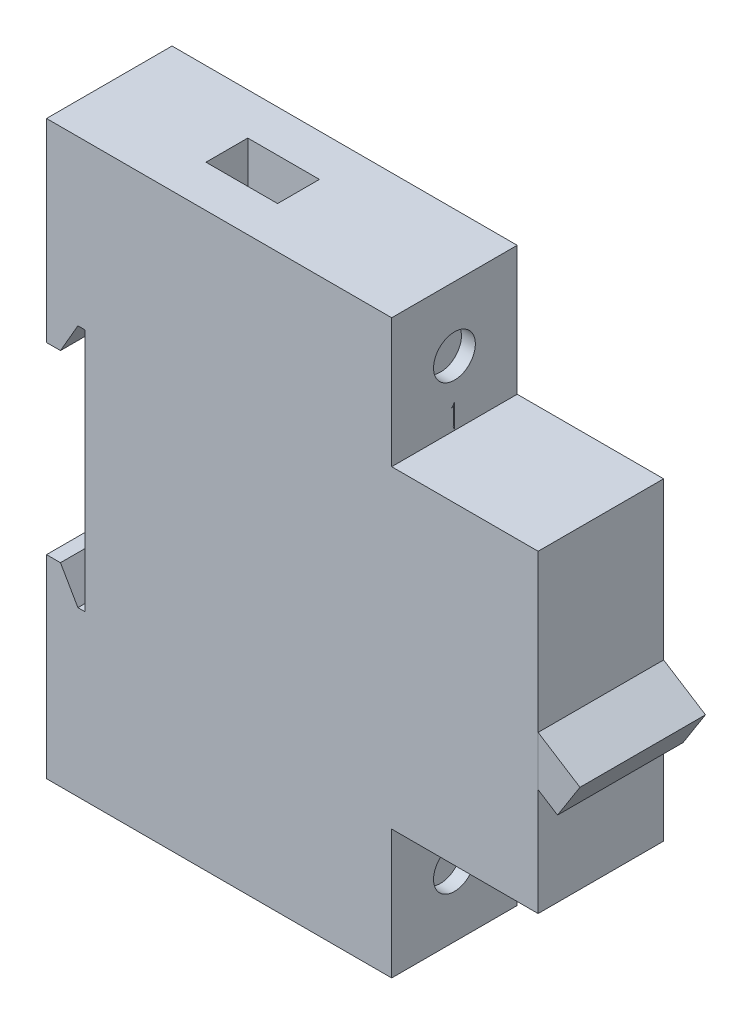
from build123d import *

# Parameters (mm, degrees)
EXTRUDE_1_DEPTH     = 18
SKETCH_2_R          = 3
CUT_EXTRUDE_1_DEPTH = 2
SKETCH_7_W          = 10.27440821
SKETCH_7_H          = 6
CUT_EXTRUDE_2_DEPTH = 8
EXTRUDE_3_DEPTH     = 18
CUT_EXTRUDE_3_DEPTH = 1


with BuildPart() as part:
    # 草图1 → 凸台-拉伸1 (new body)
    with BuildSketch(Plane.XY):
        Polygon((0, 13.169872981), (2, 13.169872981), (4.5, 17.5), (5.5, 17.5), (5.5, -17.5), (4.5, -17.5), (2, -13.169872981), (0, -13.169872981), (0, -41), (49.5, -41), (49.5, -22.5), (70.5, -22.5), (70.5, 22.5), (49.5, 22.5), (49.5, 41), (0, 41), align=None)
    extrude(amount=-EXTRUDE_1_DEPTH)

    # 草图2 → 切除-拉伸1 (cut)
    with BuildSketch(Plane(origin=(49.5, 0, 0), x_dir=(0, 0, -1), z_dir=(1, 0, 0))):
        with Locations((9, 31.75)):
            Circle(SKETCH_2_R)
    cut_extrude_1 = extrude(amount=-CUT_EXTRUDE_1_DEPTH, mode=Mode.SUBTRACT)

    # 草图7 → 切除-拉伸2 (cut)
    with BuildSketch(Plane(origin=(0, 41, 0), x_dir=(1, 0, 0), z_dir=(0, 1, 0))):
        with Locations((22, 9)):
            Rectangle(SKETCH_7_W, SKETCH_7_H)
    cut_extrude_2 = extrude(amount=-CUT_EXTRUDE_2_DEPTH, mode=Mode.SUBTRACT)

    # 镜向1: 切除-拉伸1, 切除-拉伸2 across plane
    add(cut_extrude_1.mirror(Plane.ZX), mode=Mode.SUBTRACT)
    add(cut_extrude_2.mirror(Plane.ZX), mode=Mode.SUBTRACT)

    # 草图4 → 凸台-拉伸3 (add, through all)
    with BuildSketch(Plane.XY):
        Polygon((70.5, 0), (76.5, -3.811982778), (73.282472113, -8.876320276), (70.5, -7.10853098), align=None)
    extrude(amount=-EXTRUDE_3_DEPTH)

    # 草图10 → 切除-拉伸3 (cut)
    with BuildSketch(Plane(origin=(49.5, 0, 0), x_dir=(0, 0, -1), z_dir=(1, 0, 0))):
        with BuildLine():
            Line((8.984338376, 26.034306414), (9.039526955, 26.034306414))
            Line((9.039526955, 26.034306414), (9.034306414, 23.360643512))
            add(Edge.make_bspline(
                [(9.034306414, 23.360643512), (9.033711696, 23.336531223), (9.032571392, 23.290298592), (9.032478847, 23.224151689), (9.030303434, 23.164261802), (9.030130163, 23.110543188), (9.028512562, 23.063066024), (9.026641962, 23.021820374), (9.026464219, 22.986728926), (9.023155462, 22.931806279), (9.01921264, 22.856291737), (9.009434644, 22.778513041), (9.001650625, 22.723092466), (8.993737527, 22.697864051), (8.983712444, 22.677902503), (8.973707431, 22.680230387), (8.969422544, 22.68122736)],
                knots=[0, 0, 0, 0, 1.45038606, 2.780953852, 3.977268029, 5.053718292, 6.010937745, 6.833690271, 7.536464333, 8.120251454, 10.142880859, 12.069479857, 12.873132744, 13.440417135, 13.76034519, 14, 14, 14, 14], degree=3))
            add(Edge.make_bspline(
                [(8.969422544, 22.68122736), (8.968432015, 22.681977123), (8.964192308, 22.68518629), (8.954081781, 22.691978917), (8.942068389, 22.710186957), (8.936809678, 22.726522015), (8.933624547, 22.736415939)],
                knots=[0, 0, 0, 0, 0.221265066, 0.947068446, 2.150880552, 4, 4, 4, 4], degree=3))
            Line((8.933624547, 22.736415939), (8.909013424, 22.8020456))
            Line((8.909013424, 22.8020456), (8.853079054, 22.98327296))
            add(Edge.make_bspline(
                [(8.853079054, 22.98327296), (8.846345762, 23.000324587), (8.834616715, 23.030027641), (8.822784696, 23.069106135), (8.813808527, 23.094059404), (8.811422734, 23.114285114), (8.822915111, 23.133256883), (8.831378853, 23.162467624), (8.84440229, 23.199753211), (8.856700876, 23.243760308), (8.867563428, 23.291309282), (8.877348693, 23.342684453), (8.882894283, 23.400567186), (8.885614611, 23.455833044), (8.887702301, 23.509042479), (8.888081602, 23.560268342), (8.889127765, 23.620921331), (8.888964335, 23.664677216), (8.888877051, 23.688046026)],
                knots=[0, 0, 0, 0, 1.220359697, 2.125803599, 2.712350858, 2.994193817, 3.439826662, 4.12562012, 5.031064022, 6.063176816, 7.167225426, 8.277459231, 9.542238136, 11.034069985, 11.961482632, 13.08703073, 14.444263491, 16, 16, 16, 16], degree=3))
            Line((8.888877051, 23.688046026), (8.893351801, 25.661410612))
            Line((8.893351801, 25.661410612), (8.631578947, 25.434689964))
            Line((8.631578947, 25.434689964), (8.611442574, 25.520455998))
            add(Edge.make_bspline(
                [(8.611442574, 25.520455998), (8.632721013, 25.542443117), (8.672608324, 25.583658879), (8.725915453, 25.643002168), (8.769758701, 25.694502744), (8.815424369, 25.754709329), (8.866552295, 25.82963605), (8.904308654, 25.89119403), (8.923929256, 25.923183465)],
                knots=[0, 0, 0, 0, 1.077185482, 2.019228619, 2.808185376, 3.45765616, 4.678836699, 6, 6, 6, 6], degree=3))
            Line((8.923929256, 25.923183465), (8.984338376, 26.034306414))
        make_face()
        with BuildLine():
            Line((8.290141842, -24.264862561), (8.214071098, -24.264862561))
            add(Edge.make_bspline(
                [(8.214071098, -24.264862561), (8.212503694, -24.240753306), (8.209515562, -24.19479092), (8.206432219, -24.129151646), (8.205130107, -24.070215602), (8.203825691, -23.99836566), (8.20583743, -23.907753799), (8.211239117, -23.83476945), (8.214071098, -23.796505434)],
                knots=[0, 0, 0, 0, 0.927540379, 1.768282303, 2.522502339, 3.190652681, 4.527123766, 6, 6, 6, 6], degree=3))
            add(Edge.make_bspline(
                [(8.214071098, -23.796505434), (8.216031005, -23.768139156), (8.219821242, -23.713282026), (8.229824245, -23.63421952), (8.241400752, -23.560955145), (8.256451308, -23.49204459), (8.276787087, -23.42460873), (8.30573727, -23.356779876), (8.341843602, -23.286234811), (8.384502274, -23.215442866), (8.431308911, -23.148644983), (8.483847419, -23.094287734), (8.53883324, -23.052856537), (8.597336847, -23.028198661), (8.653508785, -23.01286498), (8.704732991, -23.000803406), (8.750764571, -22.992373995), (8.779847301, -22.991474395), (8.793551175, -22.991050501)],
                knots=[0, 0, 0, 0, 1.238521709, 2.395159043, 3.470603583, 4.46912877, 5.466066804, 6.534123646, 7.677244524, 8.916145015, 10.13365226, 11.221244199, 12.198275335, 13.109907183, 13.966820176, 14.733954848, 15.403435577, 16, 16, 16, 16], degree=3))
            add(Edge.make_bspline(
                [(8.793551175, -22.991050501), (8.81101537, -22.992338183), (8.84552408, -22.994882602), (8.896285436, -23.006671597), (8.945310487, -23.023669567), (9.008015182, -23.053949588), (9.081338229, -23.101424485), (9.143716608, -23.163766889), (9.186880675, -23.220833206), (9.217285528, -23.269401053), (9.244229025, -23.323633808), (9.278065128, -23.402435847), (9.313462397, -23.50700687), (9.338989099, -23.639080796), (9.35535619, -23.776233689), (9.362844656, -23.91644525), (9.364237056, -24.055274867), (9.356085323, -24.145817291), (9.352149086, -24.189537609)],
                knots=[0, 0, 0, 0, 0.570779476, 1.127842599, 1.694919432, 2.261066821, 3.397481896, 4.527710891, 5.118384485, 5.730727279, 6.394748858, 7.092559246, 8.529363642, 9.986910621, 11.474321506, 13.03467297, 14.568129345, 16, 16, 16, 16], degree=3))
            add(Edge.make_bspline(
                [(9.352149086, -24.189537609), (9.344169712, -24.234509857), (9.328091909, -24.325125345), (9.293462223, -24.434225144), (9.261166115, -24.517169107), (9.234164873, -24.572750012), (9.205314313, -24.6219546), (9.163596577, -24.6801439), (9.099888143, -24.746195261), (9.040851885, -24.790490068), (9.00983074, -24.813765182)],
                knots=[0, 0, 0, 0, 1.490916612, 3.004077927, 3.729534125, 4.397912905, 5.020560084, 5.590839424, 6.734084393, 8, 8, 8, 8], degree=3))
            Line((9.00983074, -24.813765182), (8.762973719, -24.969635628))
            add(Edge.make_bspline(
                [(8.762973719, -24.969635628), (8.731516715, -24.990991392), (8.671868231, -25.031485997), (8.592221039, -25.097632031), (8.525370538, -25.167328115), (8.474841444, -25.244391364), (8.435596532, -25.323717163), (8.4007483, -25.40336802), (8.374439656, -25.491161597), (8.355727926, -25.569853451), (8.342967145, -25.63594277), (8.336575014, -25.682034871), (8.331382273, -25.722771633), (8.33072366, -25.748228452), (8.330414588, -25.760174728)],
                knots=[0, 0, 0, 0, 1.453572249, 2.75625039, 3.953730064, 5.132566341, 6.263730064, 7.337486329, 8.453238547, 9.76321854, 10.430854957, 11.026567013, 11.543191201, 12, 12, 12, 12], degree=3))
            Line((8.330414588, -25.760174728), (8.319973506, -25.971233752))
            Line((8.319973506, -25.971233752), (9.220889764, -25.941402088))
            add(Edge.make_bspline(
                [(9.220889764, -25.941402088), (9.232450042, -25.940755724), (9.252754483, -25.939620451), (9.272268297, -25.918347064), (9.276611847, -25.892372243), (9.284319205, -25.860423962), (9.290049098, -25.81462895), (9.29446931, -25.779802597), (9.296960508, -25.760174728)],
                knots=[0, 0, 0, 0, 0.925905201, 1.626257371, 2.181371879, 3.087088273, 4.358305093, 6, 6, 6, 6], degree=3))
            Line((9.296960508, -25.760174728), (9.317096881, -25.321649265))
            Line((9.317096881, -25.321649265), (9.387201292, -25.321649265))
            Line((9.387201292, -25.321649265), (9.412558206, -25.986149584))
            add(Edge.make_bspline(
                [(9.412558206, -25.986149584), (9.413405902, -25.999068195), (9.414888522, -26.021662858), (9.415610241, -26.051552331), (9.415630669, -26.072364854), (9.4153159, -26.089168854), (9.40990371, -26.103860909), (9.404874697, -26.120908527), (9.385256989, -26.130539629), (9.357057927, -26.133621158), (9.314201622, -26.137985434), (9.280565773, -26.137706301), (9.261162511, -26.13754528)],
                knots=[0, 0, 0, 0, 1.385018147, 2.4223982, 3.193529914, 3.619812046, 4.200562765, 4.878496499, 5.402948042, 6.404258339, 7.925751149, 10, 10, 10, 10], degree=3))
            Line((9.261162511, -26.13754528), (8.259564386, -26.162902195))
            add(Edge.make_bspline(
                [(8.259564386, -26.162902195), (8.247388947, -26.162937814), (8.223390257, -26.163008021), (8.198797263, -26.139144046), (8.188473631, -26.109929903), (8.183306694, -26.075568207), (8.179845757, -26.029981614), (8.178183336, -25.951575476), (8.181737539, -25.840015589), (8.189743279, -25.747961164), (8.193934725, -25.699765608)],
                knots=[0, 0, 0, 0, 0.556373901, 1.096654043, 1.476064089, 2.012759395, 2.73145082, 3.635924119, 5.715166189, 8, 8, 8, 8], degree=3))
            add(Edge.make_bspline(
                [(8.193934725, -25.699765608), (8.197654284, -25.671633927), (8.204819448, -25.617442544), (8.219387903, -25.539436814), (8.234920239, -25.467030035), (8.251776922, -25.400266013), (8.270385871, -25.339496475), (8.290697487, -25.284790992), (8.311753608, -25.235268508), (8.343380993, -25.17924562), (8.383576937, -25.118178785), (8.429297617, -25.052334036), (8.473317727, -24.996480007), (8.530854156, -24.935031572), (8.608747466, -24.867959994), (8.674182801, -24.818848521), (8.70778514, -24.793628809)],
                knots=[0, 0, 0, 0, 1.103491021, 2.125706759, 3.085324024, 3.98349739, 4.803138144, 5.555704107, 6.252741852, 6.89323317, 8.054555834, 9.09539633, 10.010480884, 10.817709087, 12.365830683, 14, 14, 14, 14], degree=3))
            Line((8.70778514, -24.793628809), (8.914369415, -24.662369486))
            add(Edge.make_bspline(
                [(8.914369415, -24.662369486), (8.930908696, -24.651373167), (8.962647374, -24.630271365), (9.006485229, -24.596675584), (9.043858644, -24.561817573), (9.076065836, -24.524201226), (9.10522139, -24.480673778), (9.1291657, -24.426417496), (9.154479178, -24.362508819), (9.183993288, -24.263078861), (9.214424468, -24.131840057), (9.226090084, -23.969689346), (9.219858207, -23.805435751), (9.200806183, -23.696415737), (9.1910581, -23.640634988)],
                knots=[0, 0, 0, 0, 0.635613896, 1.219735276, 1.765761318, 2.268061313, 2.802129131, 3.435697723, 4.161225462, 5.001884758, 6.75303811, 8.46119913, 10.189351173, 12, 12, 12, 12], degree=3))
            add(Edge.make_bspline(
                [(9.1910581, -23.640634988), (9.183712754, -23.612197988), (9.16938689, -23.556736394), (9.14227215, -23.476841805), (9.10717378, -23.404075735), (9.069606264, -23.33610105), (9.022541266, -23.276599716), (8.959849981, -23.233865922), (8.885788733, -23.205299367), (8.831614798, -23.200268961), (8.803246465, -23.197634775)],
                knots=[0, 0, 0, 0, 1.101106684, 2.147523679, 3.156537618, 4.125318695, 5.058520457, 5.968677808, 6.93629249, 8, 8, 8, 8], degree=3))
            add(Edge.make_bspline(
                [(8.803246465, -23.197634775), (8.788314069, -23.197481899), (8.758530359, -23.197176976), (8.714168837, -23.203904277), (8.671021145, -23.218009595), (8.614342728, -23.243574701), (8.548849679, -23.291195576), (8.479913317, -23.36304645), (8.42305178, -23.450777932), (8.379272752, -23.552442718), (8.346354182, -23.668266624), (8.319630748, -23.798073758), (8.302083371, -23.943510229), (8.297180933, -24.04530483), (8.294616591, -24.098551033)],
                knots=[0, 0, 0, 0, 0.469335518, 0.936122588, 1.403629858, 1.893624907, 2.887406355, 3.927357629, 5.011993806, 6.157121359, 7.396943717, 8.794309501, 10.323183677, 12, 12, 12, 12], degree=3))
            Line((8.294616591, -24.098551033), (8.290141842, -24.264862561))
        make_face()
    extrude(amount=-CUT_EXTRUDE_3_DEPTH, mode=Mode.SUBTRACT)


solid = part.part
